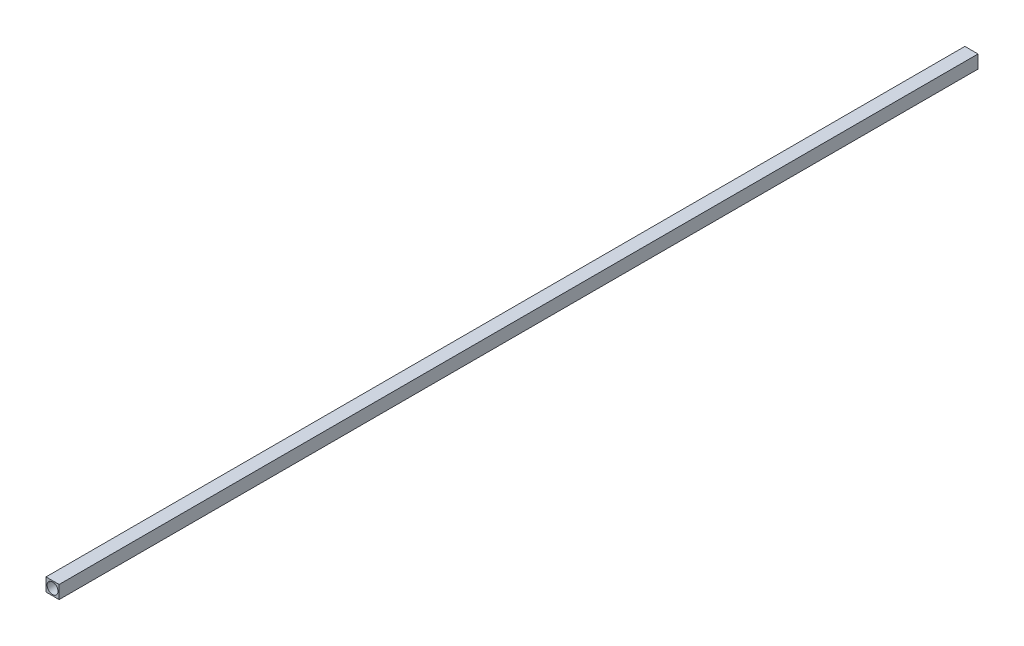
from build123d import *

# Parameters (mm, degrees)
SKETCH1_W           = 6
SKETCH1_H           = 6
SKETCH1_R           = 2.5
BOSS_EXTRUDE1_DEPTH = 420


with BuildPart() as part:
    # Sketch1 → Boss-Extrude1 (new body)
    with BuildSketch(Plane.XY):
        with Locations((3, 3)):
            Rectangle(SKETCH1_W, SKETCH1_H)
        with Locations((3, 3)):
            Circle(SKETCH1_R, mode=Mode.SUBTRACT)
    extrude(amount=BOSS_EXTRUDE1_DEPTH)


solid = part.part
